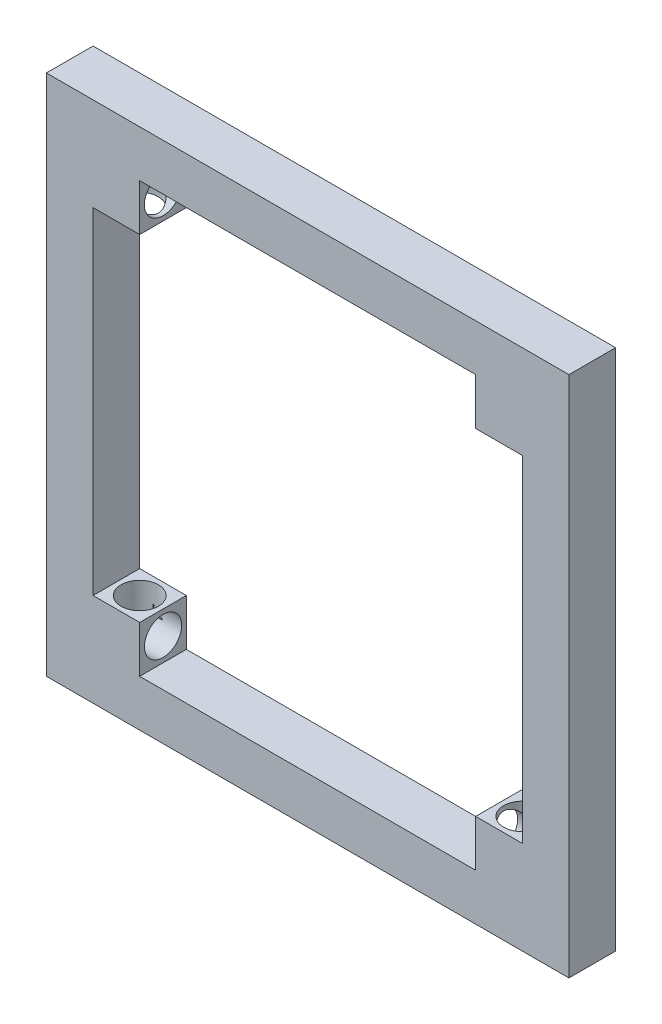
from build123d import *

# Parameters (mm, degrees)
CROQUIS1_W                = 112
CROQUIS1_H                = 112
SALIENTE_EXTRUIR1_DEPTH   = 10
CROQUIS2_R                = 4
CORTAR_EXTRUIR1_DEPTH     = 6
CROQUIS3_R                = 4
CORTAR_EXTRUIR2_DEPTH     = 6
SIMETR_A2_COPY_1_SKETCH_R = 4
SIMETR_A2_COPY_1_DEPTH    = 6
SIMETR_A2_COPY_2_SKETCH_R = 4
SIMETR_A2_COPY_2_DEPTH    = 6


with BuildPart() as part:
    # Croquis1 → Saliente-Extruir1 (new body)
    with BuildSketch(Plane.XY):
        with Locations((56, 56)):
            Rectangle(CROQUIS1_W, CROQUIS1_H)
        Polygon((20, 10), (92, 10), (92, 20), (102, 20), (102, 92), (92, 92), (92, 102), (20, 102), (20, 92), (10, 92), (10, 20), (20, 20), align=None, mode=Mode.SUBTRACT)
    extrude(amount=SALIENTE_EXTRUIR1_DEPTH)

    # Croquis2 → Cortar-Extruir1 (cut)
    with BuildSketch(Plane.XZ.offset(-92)):
        with Locations((97, 5)):
            Circle(CROQUIS2_R)
    cortar_extruir1 = extrude(amount=-CORTAR_EXTRUIR1_DEPTH, mode=Mode.SUBTRACT)

    # Croquis3 → Cortar-Extruir2 (cut)
    with BuildSketch(Plane.ZY.offset(-92)):
        with Locations((5, 97)):
            Circle(CROQUIS3_R)
    cortar_extruir2 = extrude(amount=-CORTAR_EXTRUIR2_DEPTH, mode=Mode.SUBTRACT)

    # Simetría1: Cortar-Extruir1, Cortar-Extruir2 across plane
    add(cortar_extruir1.mirror(Plane.ZY.offset(-56)), mode=Mode.SUBTRACT)
    add(cortar_extruir2.mirror(Plane.ZY.offset(-56)), mode=Mode.SUBTRACT)

    # Simetría2: Cortar-Extruir1, Cortar-Extruir2 across plane
    add(cortar_extruir1.mirror(Plane.ZX.offset(56)), mode=Mode.SUBTRACT)
    add(cortar_extruir2.mirror(Plane.ZX.offset(56)), mode=Mode.SUBTRACT)

    # Simetría2 copy 1 sketch → Simetría2 copy 1 (cut)
    with BuildSketch(Plane(origin=(112, 20, 0), x_dir=(-1, 0, 0), z_dir=(0, 1, 0))):
        with Locations((97, 5)):
            Circle(SIMETR_A2_COPY_1_SKETCH_R)
    extrude(amount=-SIMETR_A2_COPY_1_DEPTH, mode=Mode.SUBTRACT)

    # Simetría2 copy 2 sketch → Simetría2 copy 2 (cut)
    with BuildSketch(Plane(origin=(20, 112, 0), x_dir=(0, 0, 1), z_dir=(1, 0, 0))):
        with Locations((5, 97)):
            Circle(SIMETR_A2_COPY_2_SKETCH_R)
    extrude(amount=-SIMETR_A2_COPY_2_DEPTH, mode=Mode.SUBTRACT)


solid = part.part
